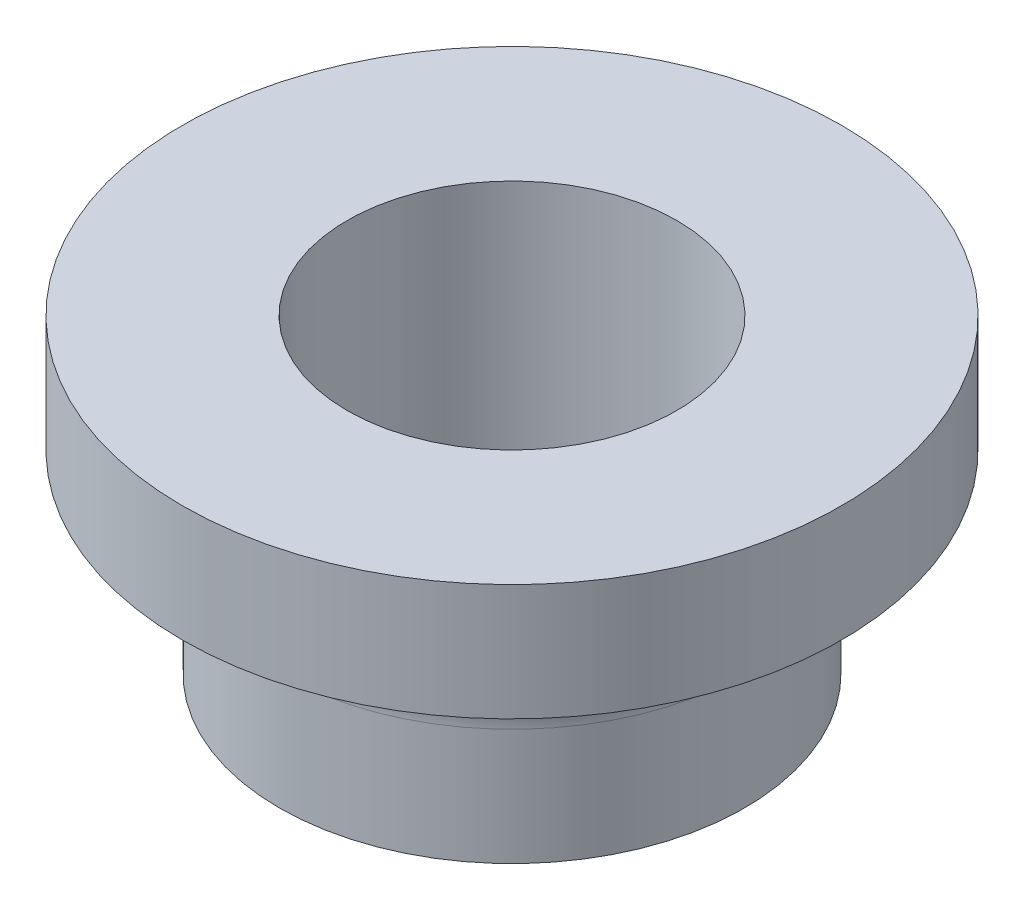
from build123d import *

# Parameters (mm, degrees)
SKETCH1_R           = 6
BOSS_EXTRUDE1_DEPTH = 5
SKETCH2_R           = 8.5
BOSS_EXTRUDE2_DEPTH = 3
FILLET1_R           = 2
SKETCH3_R           = 4.25
CUT_EXTRUDE1_DEPTH  = 8


with BuildPart() as part:
    # Sketch1 → Boss-Extrude1 (new body)
    with BuildSketch(Plane(origin=(0, 0, 0), x_dir=(1, 0, 0), z_dir=(0, 1, 0))):
        with Locations(Location((0, 0, 0), (0, 0, 270))):
            Circle(SKETCH1_R)
    extrude(amount=BOSS_EXTRUDE1_DEPTH)

    # Sketch2 → Boss-Extrude2 (add)
    with BuildSketch(Plane(origin=(0, 5, 0), x_dir=(1, 0, 0), z_dir=(0, 1, 0))):
        with Locations(Location((0, 0, 0), (0, 0, 270))):
            Circle(SKETCH2_R)
    extrude(amount=BOSS_EXTRUDE2_DEPTH)

    # Fillet1
    fillet1_edges = [part.edges().sort_by_distance(p)[0] for p in [
        (0, 5, -6),
    ]]
    fillet(fillet1_edges, radius=FILLET1_R)

    # Sketch3 → Cut-Extrude1 (cut)
    with BuildSketch(Plane(origin=(0, 8, 0), x_dir=(1, 0, 0), z_dir=(0, 1, 0))):
        with Locations(Location((0, 0, 0), (0, 0, 270))):
            Circle(SKETCH3_R)
    extrude(amount=-CUT_EXTRUDE1_DEPTH, mode=Mode.SUBTRACT)


solid = part.part
